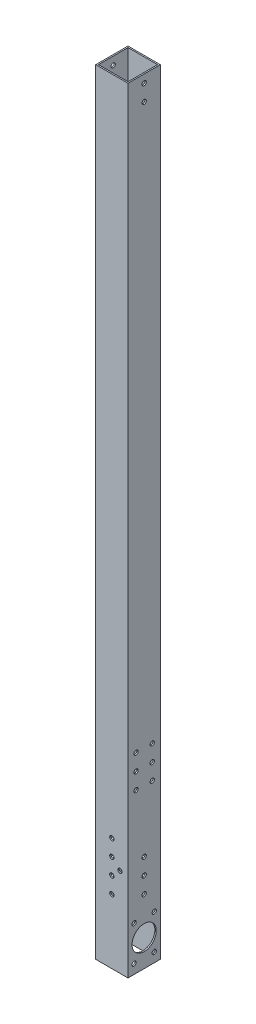
from build123d import *

# Parameters (mm, degrees)
SKETCH1_W           = 38.1
SKETCH1_H           = 38.1
SKETCH1_W_2         = 34.925
SKETCH1_H_2         = 34.925
BOSS_EXTRUDE1_DEPTH = 914.4
SKETCH2_R           = 2.5527
CUT_EXTRUDE1_DEPTH  = 916.391649787
SKETCH3_R           = 2.5527
CUT_EXTRUDE2_DEPTH  = 916.391649787
SKETCH4_R           = 14.2875
SKETCH4_R_2         = 2.5527
CUT_EXTRUDE3_DEPTH  = 916.391649787


with BuildPart() as part:
    # Sketch1 → Boss-Extrude1 (new body)
    with BuildSketch(Plane(origin=(0, 0, 0), x_dir=(1, 0, 0), z_dir=(0, 1, 0))):
        Rectangle(SKETCH1_W, SKETCH1_H)
        Rectangle(SKETCH1_W_2, SKETCH1_H_2, mode=Mode.SUBTRACT)
    extrude(amount=BOSS_EXTRUDE1_DEPTH)

    # Sketch2 → Cut-Extrude1 (cut, through all)
    with BuildSketch(Plane.XY.offset(19.05)):
        with Locations((0, 76.2)):
            Circle(SKETCH2_R)
        with Locations((0, 95.25)):
            Circle(SKETCH2_R)
        with Locations((0, 114.3)):
            Circle(SKETCH2_R)
        with Locations((0, 133.35)):
            Circle(SKETCH2_R)
        with Locations((9.525, 104.775)):
            Circle(SKETCH2_R)
    extrude(amount=-CUT_EXTRUDE1_DEPTH, mode=Mode.SUBTRACT)

    # Sketch3 → Cut-Extrude2 (cut, through all)
    with BuildSketch(Plane(origin=(19.05, 0, 0), x_dir=(0, 0, -1), z_dir=(1, 0, 0))):
        with Locations((0, 76.2)):
            Circle(SKETCH3_R)
        with Locations((0, 95.25)):
            Circle(SKETCH3_R)
        with Locations((0, 114.3)):
            Circle(SKETCH3_R)
        with Locations((-9.525, 225.425)):
            Circle(SKETCH3_R)
        with Locations((-9.525, 206.375)):
            Circle(SKETCH3_R)
        with Locations((-9.525, 187.325)):
            Circle(SKETCH3_R)
        with Locations((9.525, 187.325)):
            Circle(SKETCH3_R)
        with Locations((9.525, 206.375)):
            Circle(SKETCH3_R)
        with Locations((9.525, 225.425)):
            Circle(SKETCH3_R)
        with Locations((0, 904.875)):
            Circle(SKETCH3_R)
        with Locations((0, 885.825)):
            Circle(SKETCH3_R)
    extrude(amount=-CUT_EXTRUDE2_DEPTH, mode=Mode.SUBTRACT)

    # Sketch4 → Cut-Extrude3 (cut, through all)
    with BuildSketch(Plane(origin=(19.05, 0, 0), x_dir=(0, 0, -1), z_dir=(1, 0, 0))):
        with Locations((0, 31.75)):
            Circle(SKETCH4_R)
        with Locations((-11.90625, 52.372229928)):
            Circle(SKETCH4_R_2)
        with Locations((11.90625, 52.372229928)):
            Circle(SKETCH4_R_2)
        with Locations((11.90625, 11.127770072)):
            Circle(SKETCH4_R_2)
        with Locations((-11.90625, 11.127770072)):
            Circle(SKETCH4_R_2)
    extrude(amount=-CUT_EXTRUDE3_DEPTH, mode=Mode.SUBTRACT)


solid = part.part
